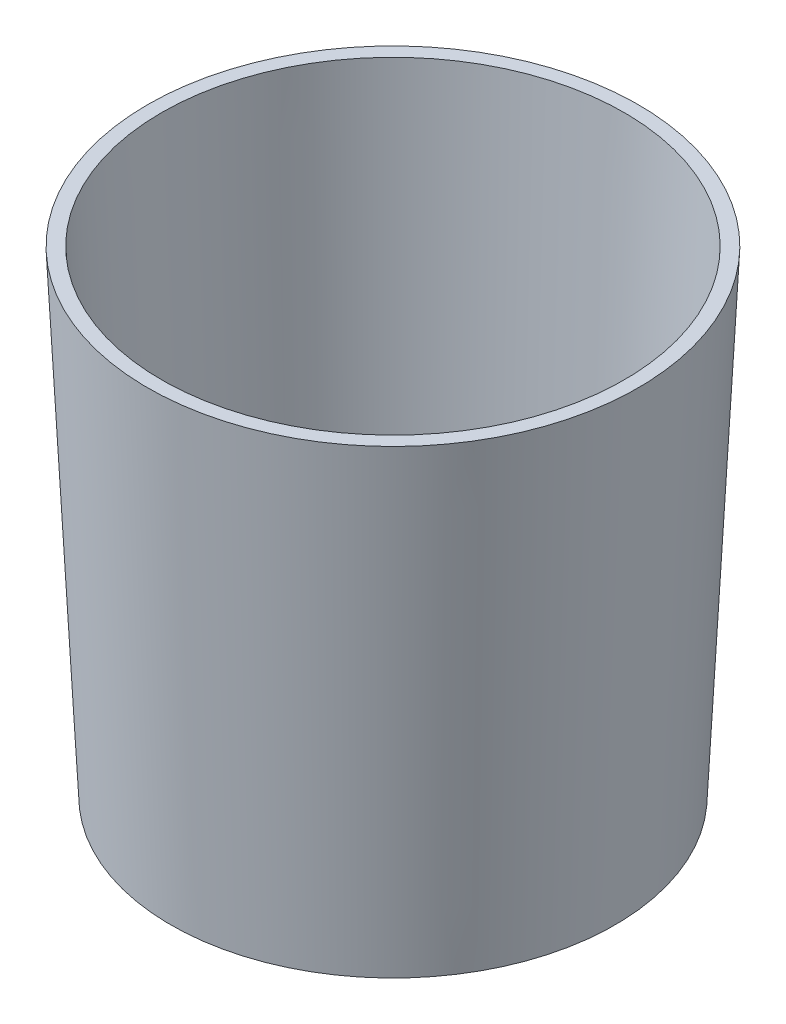
from build123d import *

# Parameters (mm, degrees)
SKETCH3_R          = 50
CUT_EXTRUDE1_DEPTH = 100
CUT_EXTRUDE1_DRAFT = -2.6


with BuildPart() as part:
    # Sketch1 → Revolve1 (revolve)
    with BuildSketch(Plane.XY, mode=Mode.PRIVATE) as revolve1_sk:
        Polygon((0, 36.75), (0, -66.25), (48, -66.25), (53, 36.75), align=None)
    revolve(revolve1_sk.sketch.rotate(Axis((0, 36.75, 0), (0, -1, 0)), 180), axis=Axis((0, 36.75, 0), (0, -1, 0)))


with BuildPart() as cut_extrude1_tool:
    # Sketch3 → Cut-Extrude1 (with draft: the straight prism first)
    with BuildSketch(Plane(origin=(0, 36.75, 0), x_dir=(1, 0, 0), z_dir=(0, 1, 0))):
        Circle(SKETCH3_R)
    extrude(amount=-CUT_EXTRUDE1_DEPTH)
    # Cut-Extrude1: the draft: its side faces are tilted about the plane it starts from
    cut_extrude1_sides = [cut_extrude1_tool.faces().sort_by_distance(p)[0] for p in [
        (-50, -13.25, 0),
    ]]
    draft(cut_extrude1_sides, Plane(origin=(0, 36.75, 0), x_dir=(1, 0, 0), z_dir=(0, 1, 0)), CUT_EXTRUDE1_DRAFT)


with BuildPart() as part_1:
    add(part.part)

    # Cut-Extrude1: cut by cut_extrude1_tool
    add(cut_extrude1_tool.part, mode=Mode.SUBTRACT)


solid = part_1.part
